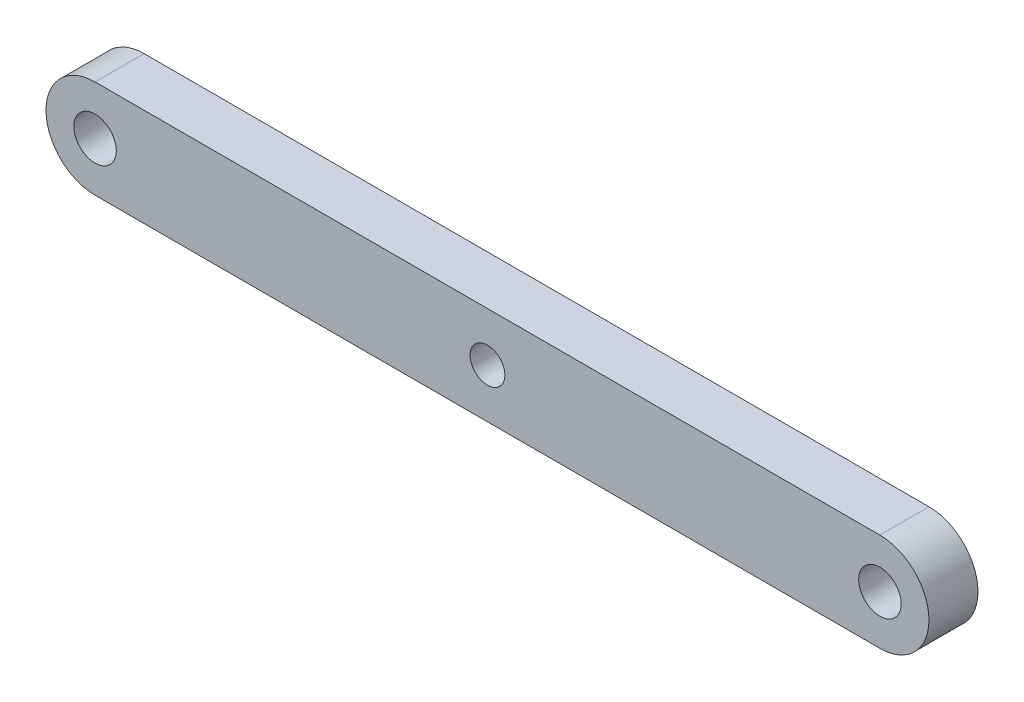
from build123d import *

# Parameters (mm, degrees)
BOSS_EXTRUDE1_DEPTH  = 6.35
M5_CLEARANCE_HOLE1_D = 5.5
M4_CLEARANCE_HOLE1_D = 4.5
M5_CLEARANCE_HOLE2_D = 5.5


with BuildPart() as part:
    # Sketch1 → Boss-Extrude1 (new body)
    with BuildSketch(Plane.XY):
        with BuildLine():
            Line((0, 6.35), (101.6, 6.35))
            ThreePointArc((101.6, 6.35), (107.95, 0), (101.6, -6.35))
            Line((101.6, -6.35), (0, -6.35))
            ThreePointArc((0, -6.35), (-6.35, 0), (0, 6.35))
        make_face()
    extrude(amount=BOSS_EXTRUDE1_DEPTH)

    # M5 Clearance Hole1 (through all)
    with Locations(Plane(origin=(0, 0, 0), x_dir=(-1, 0, 0), z_dir=(0, 0, -1))):
        with Locations((-101.6, 0)):
            Hole(M5_CLEARANCE_HOLE1_D / 2)

    # M4 Clearance Hole1 (through all)
    with Locations(Plane(origin=(0, 0, 0), x_dir=(-1, 0, 0), z_dir=(0, 0, -1))):
        with Locations((-50.8, 0)):
            Hole(M4_CLEARANCE_HOLE1_D / 2)

    # M5 Clearance Hole2 (through all)
    with Locations(Plane.XY.offset(6.35)):
        with Locations((0, 0)):
            Hole(M5_CLEARANCE_HOLE2_D / 2)


solid = part.part
